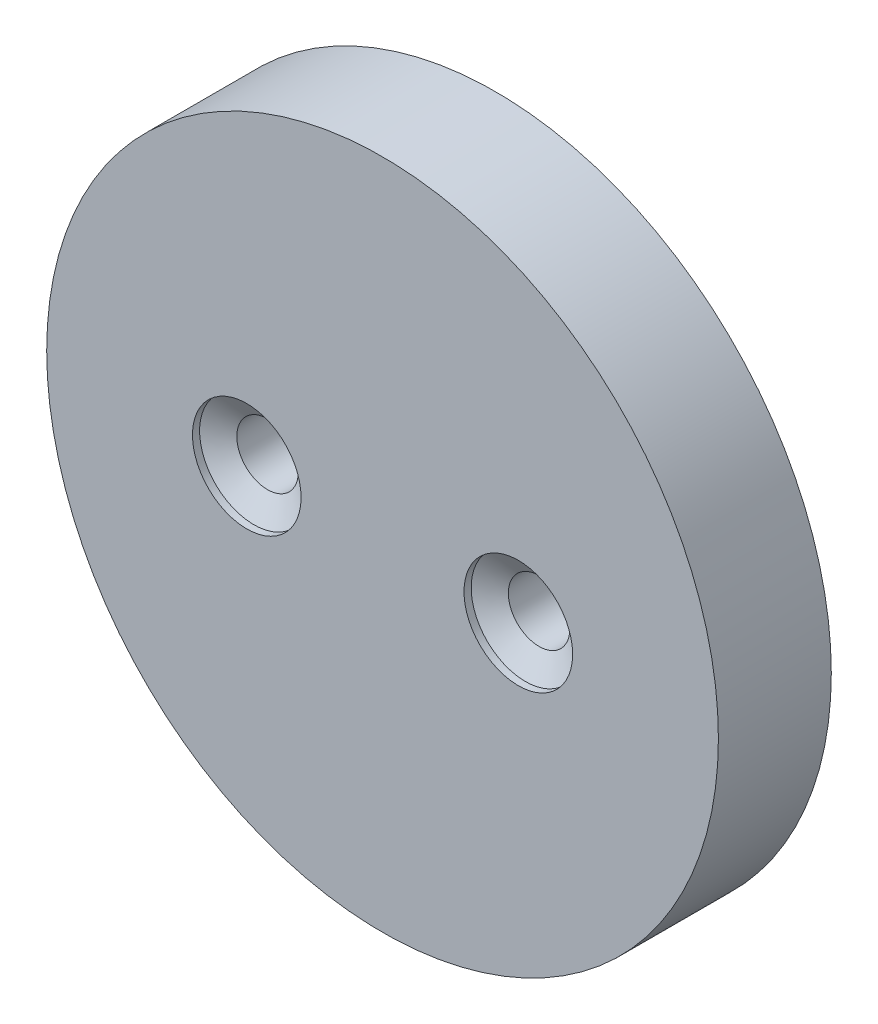
from build123d import *

# Parameters (mm, degrees)
SKETCH1_R           = 23.5
BOSS_EXTRUDE1_DEPTH = 7.9
CUT_EXTRUDE1_REACH  = 36.16
SKETCH2_R           = 2.15
SKETCH3_R           = 3.8
CUT_EXTRUDE2_DEPTH  = 0.5


with BuildPart() as part:
    # Sketch1 → Boss-Extrude1 (new body)
    with BuildSketch(Plane.XY):
        Circle(SKETCH1_R)
    extrude(amount=BOSS_EXTRUDE1_DEPTH)

    # Sketch2 → Cut-Extrude1 (cut, up to next)
    with BuildSketch(Plane.XY.offset(7.9), mode=Mode.PRIVATE) as cut_extrude1_sk1:
        with Locations((-9.5, 0)):
            Circle(SKETCH2_R)
    cut_extrude1_tool1 = extrude(cut_extrude1_sk1.sketch, amount=-CUT_EXTRUDE1_REACH, mode=Mode.PRIVATE) & part.part
    # Sketch2 → Cut-Extrude1 (cut, up to next)
    with BuildSketch(Plane.XY.offset(7.9), mode=Mode.PRIVATE) as cut_extrude1_sk2:
        with Locations((9.5, 0)):
            Circle(SKETCH2_R)
    cut_extrude1_tool2 = extrude(cut_extrude1_sk2.sketch, amount=-CUT_EXTRUDE1_REACH, mode=Mode.PRIVATE) & part.part
    add(cut_extrude1_tool1.solids().sort_by_distance((-9.5, 0, 7.9))[0], mode=Mode.SUBTRACT)
    add(cut_extrude1_tool2.solids().sort_by_distance((9.5, 0, 7.9))[0], mode=Mode.SUBTRACT)

    # Sketch3 → Cut-Extrude2 (cut)
    with BuildSketch(Plane.XY.offset(7.9)):
        with Locations((-9.5, 0)):
            Circle(SKETCH3_R)
        with Locations((9.5, 0)):
            Circle(SKETCH3_R)
    extrude(amount=-CUT_EXTRUDE2_DEPTH, mode=Mode.SUBTRACT)

    # Sketch7 → Cut-Revolve5 (revolve, cut)
    with BuildSketch(Plane(origin=(0, 0, 0), x_dir=(1, 0, 0), z_dir=(0, 1, 0)), mode=Mode.PRIVATE) as cut_revolve5_sk:
        Polygon((9.5, -7.4), (9.5, -5.206068977), (5.7, -7.4), align=None)
    revolve(cut_revolve5_sk.sketch.rotate(Axis((9.5, 0, 7.4), (0, 0, -1)), 180), axis=Axis((9.5, 0, 7.4), (0, 0, -1)), mode=Mode.SUBTRACT)

    # Sketch6 → Cut-Revolve6 (revolve, cut)
    with BuildSketch(Plane(origin=(0, 0, 0), x_dir=(1, 0, 0), z_dir=(0, 1, 0)), mode=Mode.PRIVATE) as cut_revolve6_sk:
        Polygon((-9.5, -7.4), (-9.5, -5.206068977), (-13.3, -7.4), align=None)
    revolve(cut_revolve6_sk.sketch.rotate(Axis((-9.5, 0, 7.4), (0, 0, -1)), 180), axis=Axis((-9.5, 0, 7.4), (0, 0, -1)), mode=Mode.SUBTRACT)


solid = part.part
